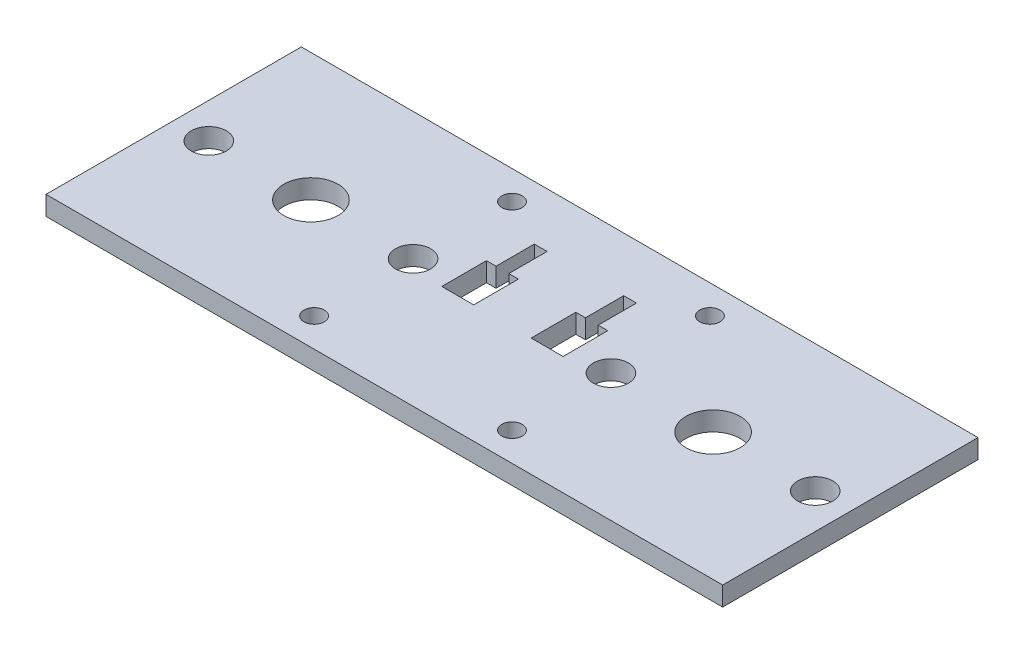
from build123d import *

# Parameters (mm, degrees)
SKETCH_1_W          = 106
SKETCH_1_H          = 40
EXTRUDE_1_DEPTH     = 3
CUT_EXTRUDE_1_REACH = 58.727
SKETCH_2_R          = 4.25
SKETCH_2_R_2        = 2.75
CUT_EXTRUDE_2_REACH = 58.727
SKETCH_3_R          = 1.6
CUT_EXTRUDE_3_REACH = 58.727


with BuildPart() as part:
    # 草图1 → 凸台-拉伸1 (new body)
    with BuildSketch(Plane(origin=(0, 0, 0), x_dir=(1, 0, 0), z_dir=(0, 1, 0))):
        Rectangle(SKETCH_1_W, SKETCH_1_H)
    extrude(amount=EXTRUDE_1_DEPTH)

    # 草图2 → 切除-拉伸1 (cut, up to next)
    with BuildSketch(Plane(origin=(0, 3, 0), x_dir=(1, 0, 0), z_dir=(0, 1, 0)), mode=Mode.PRIVATE) as cut_extrude_1_sk1:
        with Locations(Location((-31.5, 0, 0), (0, 0, 270))):
            Circle(SKETCH_2_R)
    cut_extrude_1_tool1 = extrude(cut_extrude_1_sk1.sketch, amount=-CUT_EXTRUDE_1_REACH, mode=Mode.PRIVATE) & part.part
    # 草图2 → 切除-拉伸1 (cut, up to next)
    with BuildSketch(Plane(origin=(0, 3, 0), x_dir=(1, 0, 0), z_dir=(0, 1, 0)), mode=Mode.PRIVATE) as cut_extrude_1_sk2:
        with Locations(Location((31.5, 0, 0), (0, 0, 270))):
            Circle(SKETCH_2_R)
    cut_extrude_1_tool2 = extrude(cut_extrude_1_sk2.sketch, amount=-CUT_EXTRUDE_1_REACH, mode=Mode.PRIVATE) & part.part
    # 草图2 → 切除-拉伸1 (cut, up to next)
    with BuildSketch(Plane(origin=(0, 3, 0), x_dir=(1, 0, 0), z_dir=(0, 1, 0)), mode=Mode.PRIVATE) as cut_extrude_1_sk3:
        with Locations(Location((-47.5, 0, 0), (0, 0, 270))):
            Circle(SKETCH_2_R_2)
    cut_extrude_1_tool3 = extrude(cut_extrude_1_sk3.sketch, amount=-CUT_EXTRUDE_1_REACH, mode=Mode.PRIVATE) & part.part
    # 草图2 → 切除-拉伸1 (cut, up to next)
    with BuildSketch(Plane(origin=(0, 3, 0), x_dir=(1, 0, 0), z_dir=(0, 1, 0)), mode=Mode.PRIVATE) as cut_extrude_1_sk4:
        with Locations(Location((-15.5, 0, 0), (0, 0, 270))):
            Circle(SKETCH_2_R_2)
    cut_extrude_1_tool4 = extrude(cut_extrude_1_sk4.sketch, amount=-CUT_EXTRUDE_1_REACH, mode=Mode.PRIVATE) & part.part
    # 草图2 → 切除-拉伸1 (cut, up to next)
    with BuildSketch(Plane(origin=(0, 3, 0), x_dir=(1, 0, 0), z_dir=(0, 1, 0)), mode=Mode.PRIVATE) as cut_extrude_1_sk5:
        with Locations(Location((15.5, 0, 0), (0, 0, 270))):
            Circle(SKETCH_2_R_2)
    cut_extrude_1_tool5 = extrude(cut_extrude_1_sk5.sketch, amount=-CUT_EXTRUDE_1_REACH, mode=Mode.PRIVATE) & part.part
    # 草图2 → 切除-拉伸1 (cut, up to next)
    with BuildSketch(Plane(origin=(0, 3, 0), x_dir=(1, 0, 0), z_dir=(0, 1, 0)), mode=Mode.PRIVATE) as cut_extrude_1_sk6:
        with Locations(Location((47.5, 0, 0), (0, 0, 270))):
            Circle(SKETCH_2_R_2)
    cut_extrude_1_tool6 = extrude(cut_extrude_1_sk6.sketch, amount=-CUT_EXTRUDE_1_REACH, mode=Mode.PRIVATE) & part.part
    add(cut_extrude_1_tool1.solids().sort_by_distance((-31.5, 3, 0))[0], mode=Mode.SUBTRACT)
    add(cut_extrude_1_tool2.solids().sort_by_distance((31.5, 3, 0))[0], mode=Mode.SUBTRACT)
    add(cut_extrude_1_tool3.solids().sort_by_distance((-47.5, 3, 0))[0], mode=Mode.SUBTRACT)
    add(cut_extrude_1_tool4.solids().sort_by_distance((-15.5, 3, 0))[0], mode=Mode.SUBTRACT)
    add(cut_extrude_1_tool5.solids().sort_by_distance((15.5, 3, 0))[0], mode=Mode.SUBTRACT)
    add(cut_extrude_1_tool6.solids().sort_by_distance((47.5, 3, 0))[0], mode=Mode.SUBTRACT)

    # 草图3 → 切除-拉伸2 (cut, up to next)
    with BuildSketch(Plane(origin=(0, 3, 0), x_dir=(1, 0, 0), z_dir=(0, 1, 0)), mode=Mode.PRIVATE) as cut_extrude_2_sk1:
        with Locations(Location((-15.5, -15.5, 0), (0, 0, 270))):
            Circle(SKETCH_3_R)
    cut_extrude_2_tool1 = extrude(cut_extrude_2_sk1.sketch, amount=-CUT_EXTRUDE_2_REACH, mode=Mode.PRIVATE) & part.part
    # 草图3 → 切除-拉伸2 (cut, up to next)
    with BuildSketch(Plane(origin=(0, 3, 0), x_dir=(1, 0, 0), z_dir=(0, 1, 0)), mode=Mode.PRIVATE) as cut_extrude_2_sk2:
        with Locations(Location((-15.5, 15.5, 0), (0, 0, 270))):
            Circle(SKETCH_3_R)
    cut_extrude_2_tool2 = extrude(cut_extrude_2_sk2.sketch, amount=-CUT_EXTRUDE_2_REACH, mode=Mode.PRIVATE) & part.part
    # 草图3 → 切除-拉伸2 (cut, up to next)
    with BuildSketch(Plane(origin=(0, 3, 0), x_dir=(1, 0, 0), z_dir=(0, 1, 0)), mode=Mode.PRIVATE) as cut_extrude_2_sk3:
        with Locations(Location((15.5, 15.5, 0), (0, 0, 270))):
            Circle(SKETCH_3_R)
    cut_extrude_2_tool3 = extrude(cut_extrude_2_sk3.sketch, amount=-CUT_EXTRUDE_2_REACH, mode=Mode.PRIVATE) & part.part
    # 草图3 → 切除-拉伸2 (cut, up to next)
    with BuildSketch(Plane(origin=(0, 3, 0), x_dir=(1, 0, 0), z_dir=(0, 1, 0)), mode=Mode.PRIVATE) as cut_extrude_2_sk4:
        with Locations(Location((15.5, -15.5, 0), (0, 0, 270))):
            Circle(SKETCH_3_R)
    cut_extrude_2_tool4 = extrude(cut_extrude_2_sk4.sketch, amount=-CUT_EXTRUDE_2_REACH, mode=Mode.PRIVATE) & part.part
    add(cut_extrude_2_tool1.solids().sort_by_distance((-15.5, 3, 15.5))[0], mode=Mode.SUBTRACT)
    add(cut_extrude_2_tool2.solids().sort_by_distance((-15.5, 3, -15.5))[0], mode=Mode.SUBTRACT)
    add(cut_extrude_2_tool3.solids().sort_by_distance((15.5, 3, -15.5))[0], mode=Mode.SUBTRACT)
    add(cut_extrude_2_tool4.solids().sort_by_distance((15.5, 3, 15.5))[0], mode=Mode.SUBTRACT)

    # 草图4 → 切除-拉伸3 (cut, up to next)
    with BuildSketch(Plane(origin=(0, 3, 0), x_dir=(1, 0, 0), z_dir=(0, 1, 0)), mode=Mode.PRIVATE) as cut_extrude_3_sk1:
        Polygon((-6, 5.5), (-4.5, 5.5), (-4.5, -1.5), (-9.5, -1.5), (-9.5, 5.5), (-8, 5.5), (-8, 11.5), (-6, 11.5), align=None)
    cut_extrude_3_tool1 = extrude(cut_extrude_3_sk1.sketch, amount=-CUT_EXTRUDE_3_REACH, mode=Mode.PRIVATE) & part.part
    # 草图4 → 切除-拉伸3 (cut, up to next)
    with BuildSketch(Plane(origin=(0, 3, 0), x_dir=(1, 0, 0), z_dir=(0, 1, 0)), mode=Mode.PRIVATE) as cut_extrude_3_sk2:
        Polygon((8, 11.5), (8, 5.5), (9.5, 5.5), (9.5, -1.5), (4.5, -1.5), (4.5, 5.5), (6, 5.5), (6, 11.5), align=None)
    cut_extrude_3_tool2 = extrude(cut_extrude_3_sk2.sketch, amount=-CUT_EXTRUDE_3_REACH, mode=Mode.PRIVATE) & part.part
    add(cut_extrude_3_tool1.solids().sort_by_distance((-7, 3, -3.659574))[0], mode=Mode.SUBTRACT)
    add(cut_extrude_3_tool2.solids().sort_by_distance((7, 3, -3.659574))[0], mode=Mode.SUBTRACT)


solid = part.part
